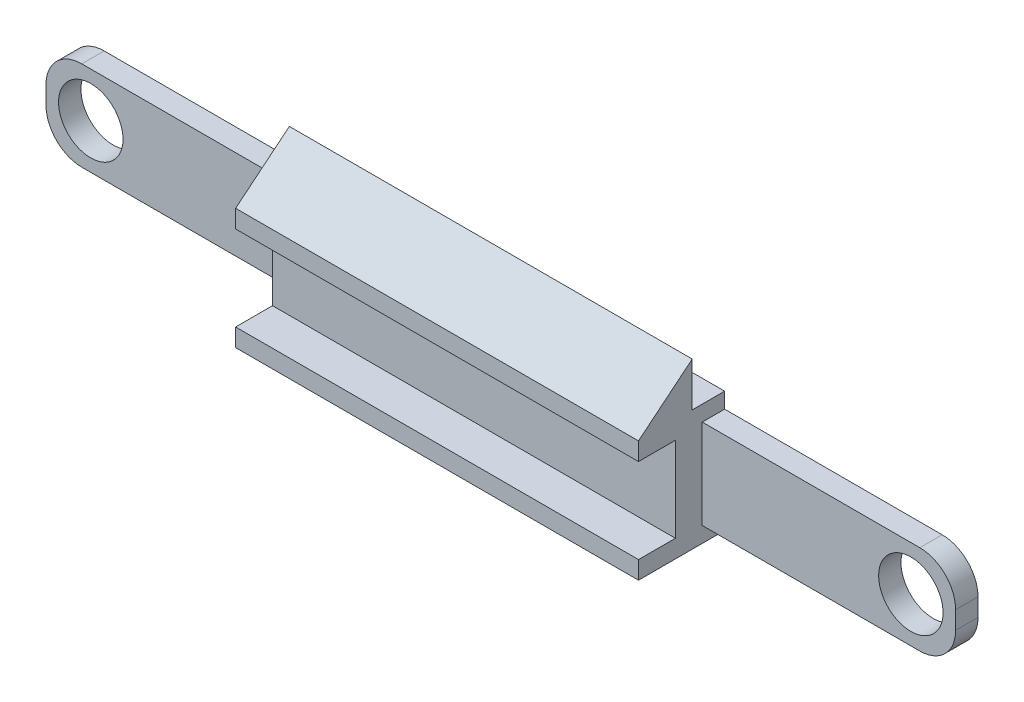
from build123d import *

# Parameters (mm, degrees)
SKETCH1_R           = 4.572
BOSS_EXTRUDE1_DEPTH = 3.175
SKETCH2_W           = 57.15
SKETCH2_H           = 3.175
BOSS_EXTRUDE2_DEPTH = 2.2098
BOSS_EXTRUDE3_DEPTH = 28.575
BOSS_EXTRUDE4_DEPTH = 57.15


with BuildPart() as part:
    # Sketch1 → Boss-Extrude1 (new body)
    with BuildSketch(Plane.XY):
        with BuildLine():
            Line((59.436, -6.35), (-59.436, -6.35))
            ThreePointArc((-59.436, -6.35), (-63.028102448, -4.862102448), (-64.516, -1.27))
            Line((-64.516, -1.27), (-64.516, 1.27))
            ThreePointArc((-64.516, 1.27), (-63.028102448, 4.862102448), (-59.436, 6.35))
            Line((-59.436, 6.35), (59.436, 6.35))
            ThreePointArc((59.436, 6.35), (63.028102448, 4.862102448), (64.516, 1.27))
            Line((64.516, 1.27), (64.516, -1.27))
            ThreePointArc((64.516, -1.27), (63.028102448, -4.862102448), (59.436, -6.35))
        make_face()
        with Locations((-58.166, 0)):
            Circle(SKETCH1_R, mode=Mode.SUBTRACT)
        with Locations(Location((58.166, 0, 0), (0, 0, 180))):
            Circle(SKETCH1_R, mode=Mode.SUBTRACT)
    extrude(amount=BOSS_EXTRUDE1_DEPTH)

    # Sketch2 → Boss-Extrude2 (add)
    with BuildSketch(Plane.XZ.offset(6.35)):
        with Locations((0, 1.5875)):
            Rectangle(SKETCH2_W, SKETCH2_H)
    boss_extrude2 = extrude(amount=BOSS_EXTRUDE2_DEPTH)

    # Sketch3 → Boss-Extrude3 (add, symmetric)
    with BuildSketch(Plane(origin=(0, 0, 0), x_dir=(0, 0, -1), z_dir=(1, 0, 0))):
        Polygon((-3.175, -8.5598), (-12.2174, -8.5598), (-12.2174, -6.0198), (-6.985, -6.0198), (-6.985, 0.3302), (-3.175, 0.3302), align=None)
    boss_extrude3 = extrude(amount=BOSS_EXTRUDE3_DEPTH, both=True)

    # Mirror1: Boss-Extrude2, Boss-Extrude3 across plane
    add(boss_extrude2.mirror(Plane.ZX))
    add(boss_extrude3.mirror(Plane.ZX))

    # Sketch7 → Boss-Extrude4 (add)
    with BuildSketch(Plane.ZY.offset(28.575)):
        Polygon((12.2174, 8.5598), (4.5974, 14.8082), (4.5974, 8.5598), align=None)
    extrude(amount=-BOSS_EXTRUDE4_DEPTH)


solid = part.part
